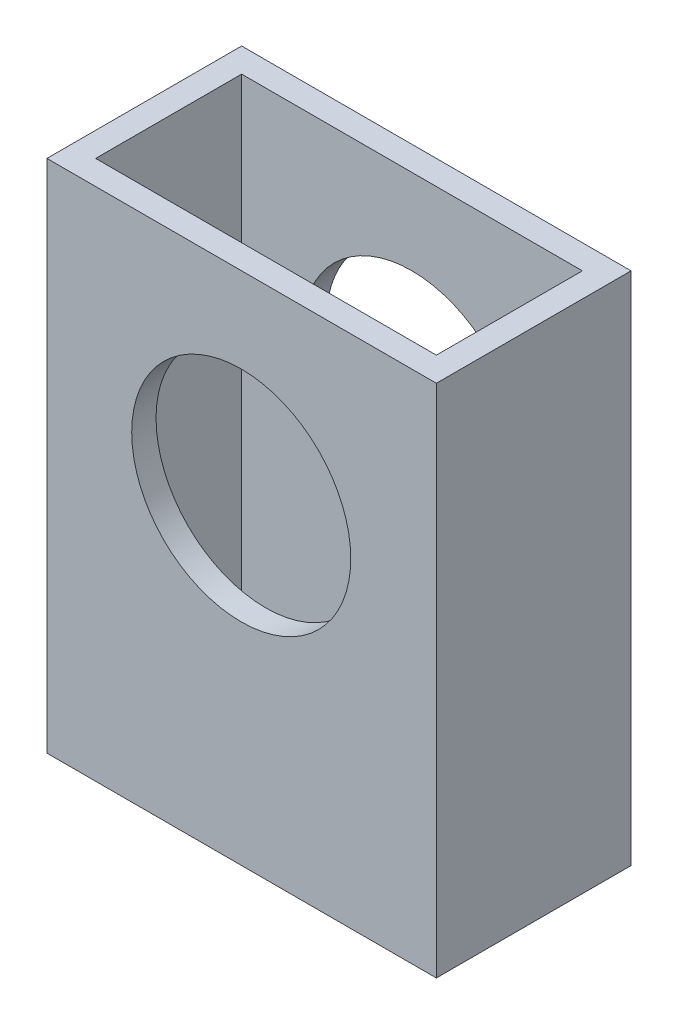
from build123d import *

# Parameters (mm, degrees)
SKETCH1_W           = 50.8
SKETCH1_H           = 67.192198053
SKETCH1_R           = 14.2875
BOSS_EXTRUDE1_DEPTH = 25.4
SKETCH2_W           = 44.45
SKETCH2_H           = 19.05
CUT_EXTRUDE1_DEPTH  = 994.32138208


with BuildPart() as part:
    # Sketch1 → Boss-Extrude1 (new body)
    with BuildSketch(Plane.XY):
        with Locations((-965.320655189, 601.353631034)):
            Rectangle(SKETCH1_W, SKETCH1_H)
        with Locations((-965.375181631, 609.54973006)):
            Circle(SKETCH1_R, mode=Mode.SUBTRACT)
    extrude(amount=BOSS_EXTRUDE1_DEPTH)

    # Sketch2 → Cut-Extrude1 (cut, through all)
    with BuildSketch(Plane(origin=(0, 634.94973006, 0), x_dir=(1, 0, 0), z_dir=(0, 1, 0))):
        with Locations((-965.320655189, -12.7)):
            Rectangle(SKETCH2_W, SKETCH2_H)
    extrude(amount=-CUT_EXTRUDE1_DEPTH, mode=Mode.SUBTRACT)


solid = part.part
